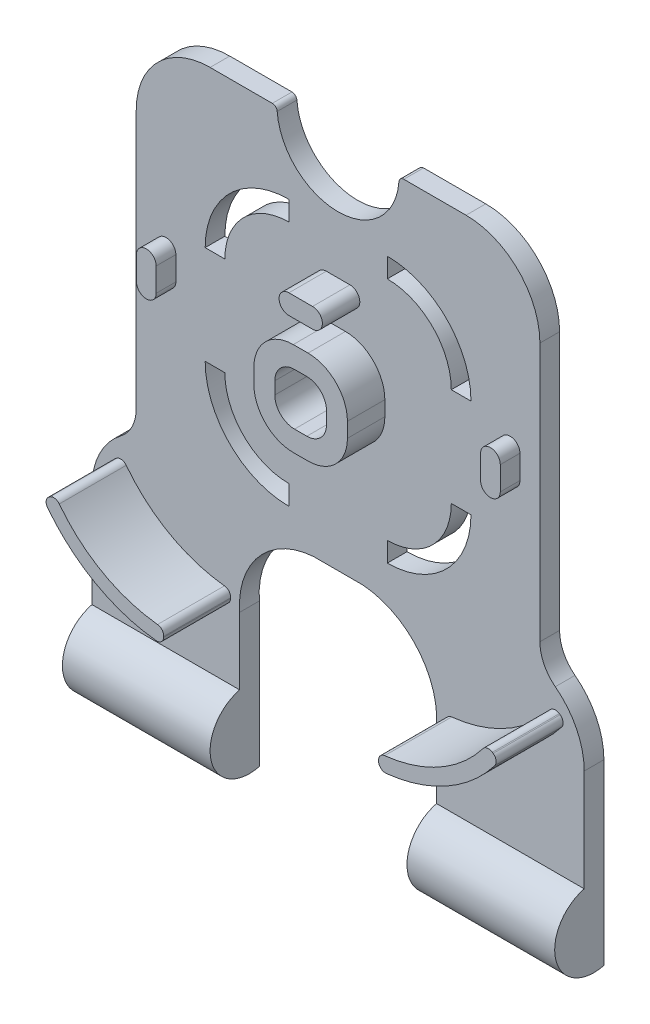
from build123d import *

# Parameters (mm, degrees)
BOSS_EXTRUDE1_DEPTH     = 4
BOSS_EXTRUDE5_DEPTH     = 100
CUT_EXTRUDE1_DEPTH      = 6
CUT_EXTRUDE1_DEPTH_BACK = 4
SKETCH10_W              = 40
SKETCH10_H              = 15.745966692
BOSS_EXTRUDE2_START     = 7.6
BOSS_EXTRUDE2_DEPTH     = 7.6
BOSS_EXTRUDE3_DEPTH     = 4
BOSS_EXTRUDE4_DEPTH     = 13.6


with BuildPart() as part:
    # Sketch5 → Boss-Extrude1 (new body)
    with BuildSketch(Plane.XY):
        with BuildLine():
            Line((24, 16.79919429), (36.637365529, 16.79919429))
            ThreePointArc((36.637365529, 16.79919429), (37.317576208, 16.532210956), (37.634577057, 15.873821155))
            ThreePointArc((37.634577057, 15.873821155), (50, 4.39919429), (62.365422943, 15.873821155))
            ThreePointArc((62.365422943, 15.873821155), (62.682423792, 16.532210956), (63.362634471, 16.79919429))
            Line((63.362634471, 16.79919429), (76, 16.79919429))
            ThreePointArc((76, 16.79919429), (86.606601718, 12.405796007), (91, 1.79919429))
            Line((91, 1.79919429), (91, -50.7428479))
            ThreePointArc((91, -50.7428479), (91.825164609, -54.281454563), (94.130434279, -57.09007798))
            ThreePointArc((94.130434279, -57.09007798), (98.452815572, -62.356247367), (100, -68.991135491))
            Line((100, -68.991135491), (100, -97.453476489))
            Line((100, -97.453476489), (70, -97.453476489))
            Line((70, -97.453476489), (70, -76.063355975))
            ThreePointArc((70, -76.063355975), (66.087194676, -64.29650022), (55, -58.7428479))
            Line((55, -58.7428479), (45, -58.7428479))
            ThreePointArc((45, -58.7428479), (33.912805324, -64.29650022), (30, -76.063355975))
            Line((30, -76.063355975), (30, -97.453476489))
            Line((30, -97.453476489), (0, -97.453476489))
            Line((0, -97.453476489), (0, -68.991135491))
            ThreePointArc((0, -68.991135491), (1.547183906, -62.356247464), (5.869565217, -57.090078366))
            ThreePointArc((5.869565217, -57.090078366), (8.17483525, -54.281454848), (9, -50.7428479))
            Line((9, -50.7428479), (9, 1.79919429))
            ThreePointArc((9, 1.79919429), (13.393398282, 12.405796007), (24, 16.79919429))
        make_face()
        with BuildLine():
            Line((23, -35.405583535), (27, -35.405583535))
            ThreePointArc((27, -35.405583535), (30.807611845, -44.59797169), (40, -48.405583535))
            Line((40, -48.405583535), (40, -52.405583535))
            ThreePointArc((40, -52.405583535), (27.97918472, -47.426398815), (23, -35.405583535))
        make_face(mode=Mode.SUBTRACT)
        with BuildLine():
            Line((60, -48.405583535), (60, -52.405583535))
            ThreePointArc((60, -52.405583535), (72.02081528, -47.426398815), (77, -35.405583535))
            Line((77, -35.405583535), (73, -35.405583535))
            ThreePointArc((73, -35.405583535), (69.192388155, -44.59797169), (60, -48.405583535))
        make_face(mode=Mode.SUBTRACT)
        with BuildLine():
            Line((73, -15.405583535), (77, -15.405583535))
            ThreePointArc((77, -15.405583535), (72.02081528, -3.384768255), (60, 1.594416465))
            Line((60, 1.594416465), (60, -2.405583535))
            ThreePointArc((60, -2.405583535), (69.192388155, -6.213195379), (73, -15.405583535))
        make_face(mode=Mode.SUBTRACT)
        with BuildLine():
            Line((40, -2.405583535), (40, 1.594416465))
            ThreePointArc((40, 1.594416465), (27.97918472, -3.384768255), (23, -15.405583535))
            Line((23, -15.405583535), (27, -15.405583535))
            ThreePointArc((27, -15.405583535), (30.807611845, -6.213195379), (40, -2.405583535))
        make_face(mode=Mode.SUBTRACT)
        with BuildLine():
            Line((48.75, -20.155583535), (51.25, -20.155583535))
            ThreePointArc((51.25, -20.155583535), (54.078427125, -21.32715641), (55.25, -24.155583535))
            Line((55.25, -24.155583535), (55.25, -26.655583535))
            ThreePointArc((55.25, -26.655583535), (54.078427125, -29.48401066), (51.25, -30.655583535))
            Line((51.25, -30.655583535), (48.75, -30.655583535))
            ThreePointArc((48.75, -30.655583535), (45.921572875, -29.48401066), (44.75, -26.655583535))
            Line((44.75, -26.655583535), (44.75, -24.155583535))
            ThreePointArc((44.75, -24.155583535), (45.921572875, -21.32715641), (48.75, -20.155583535))
        make_face(mode=Mode.SUBTRACT)
        with BuildLine():
            Line((47.613027863, -7.245609293), (52.413027863, -7.245609293))
            ThreePointArc((52.413027863, -7.245609293), (54.413027863, -9.245609293), (52.413027863, -11.245609293))
            Line((52.413027863, -11.245609293), (47.613027863, -11.245609293))
            ThreePointArc((47.613027863, -11.245609293), (45.613027863, -9.245609293), (47.613027863, -7.245609293))
        make_face(mode=Mode.SUBTRACT)
    extrude(amount=-BOSS_EXTRUDE1_DEPTH)

    # Sketch9 → Boss-Extrude5 (add)
    with BuildSketch(Plane(origin=(100, 0, 0), x_dir=(0, 0, -1), z_dir=(1, 0, 0))):
        with BuildLine():
            Line((0, -89.707509797), (0, -97.453476489))
            Line((0, -97.453476489), (4, -97.453476489))
            Line((4, -97.453476489), (4, -105.199443182))
            ThreePointArc((4, -105.199443182), (-5.745966692, -99.453476489), (0, -89.707509797))
        make_face()
    extrude(amount=-BOSS_EXTRUDE5_DEPTH)

    # Sketch10 → Cut-Extrude1 (cut, two sides: drawn at the far end of the back side and taken through both)
    with BuildSketch(Plane.XY.offset(-CUT_EXTRUDE1_DEPTH_BACK)):
        with Locations((50, -97.580493143)):
            Rectangle(SKETCH10_W, SKETCH10_H)
    extrude(amount=CUT_EXTRUDE1_DEPTH + CUT_EXTRUDE1_DEPTH_BACK, mode=Mode.SUBTRACT)

    # Sketch7 → Boss-Extrude2 (add)
    # profile 1 of 2: a face of its own
    with BuildSketch(Plane.XY.offset(BOSS_EXTRUDE2_START)):
        with BuildLine():
            Line((40.5, -23.905583535), (40.5, -26.905583535))
            ThreePointArc((40.5, -26.905583535), (42.843145751, -32.562437784), (48.5, -34.905583535))
            Line((48.5, -34.905583535), (51.5, -34.905583535))
            ThreePointArc((51.5, -34.905583535), (57.156854249, -32.562437784), (59.5, -26.905583535))
            Line((59.5, -26.905583535), (59.5, -23.905583535))
            ThreePointArc((59.5, -23.905583535), (57.156854249, -18.248729285), (51.5, -15.905583535))
            Line((51.5, -15.905583535), (48.5, -15.905583535))
            ThreePointArc((48.5, -15.905583535), (42.843145751, -18.248729285), (40.5, -23.905583535))
        make_face()
        with BuildLine():
            Line((44.75, -24.155583535), (44.75, -26.655583535))
            ThreePointArc((44.75, -26.655583535), (45.921572875, -29.48401066), (48.75, -30.655583535))
            Line((48.75, -30.655583535), (51.25, -30.655583535))
            ThreePointArc((51.25, -30.655583535), (54.078427125, -29.48401066), (55.25, -26.655583535))
            Line((55.25, -26.655583535), (55.25, -24.155583535))
            ThreePointArc((55.25, -24.155583535), (54.078427125, -21.32715641), (51.25, -20.155583535))
            Line((51.25, -20.155583535), (48.75, -20.155583535))
            ThreePointArc((48.75, -20.155583535), (45.921572875, -21.32715641), (44.75, -24.155583535))
        make_face(mode=Mode.SUBTRACT)
    # profile 2 of 2: a face of its own
    with BuildSketch(Plane.XY.offset(BOSS_EXTRUDE2_START)):
        with BuildLine():
            Line((47.613027863, -11.245609293), (52.413027863, -11.245609293))
            ThreePointArc((52.413027863, -11.245609293), (54.413027863, -9.245609293), (52.413027863, -7.245609293))
            Line((52.413027863, -7.245609293), (47.613027863, -7.245609293))
            ThreePointArc((47.613027863, -7.245609293), (45.613027863, -9.245609293), (47.613027863, -11.245609293))
        make_face()
    extrude(amount=-BOSS_EXTRUDE2_DEPTH)


with BuildPart() as boss_extrude2_piece_1:
    # of the separate pieces the step leaves, piece 1, a body of its own (boss_extrude2_pieces)
    add(part.part.solids().sort_by_distance((55, -58.7428479, 0))[0])

    # Sketch6 → Boss-Extrude3 (add)
    with BuildSketch(Plane.XY):
        with BuildLine():
            Line((13.05, -19.605583535), (13.05, -24.405583535))
            ThreePointArc((13.05, -24.405583535), (15.05, -26.405583535), (17.05, -24.405583535))
            Line((17.05, -24.405583535), (17.05, -19.605583535))
            ThreePointArc((17.05, -19.605583535), (15.05, -17.605583535), (13.05, -19.605583535))
        make_face()
        with BuildLine():
            Line((82.95, -19.605583535), (82.95, -24.405583535))
            ThreePointArc((82.95, -24.405583535), (84.95, -26.405583535), (86.95, -24.405583535))
            Line((86.95, -24.405583535), (86.95, -19.605583535))
            ThreePointArc((86.95, -19.605583535), (84.95, -17.605583535), (82.95, -19.605583535))
        make_face()
    extrude(amount=BOSS_EXTRUDE3_DEPTH)

    # Sketch8 → Boss-Extrude4 (add)
    with BuildSketch(Plane.XY):
        with BuildLine():
            Line((5.051952567, -61.420170717), (4.889119672, -61.533180939))
            ThreePointArc((4.889119672, -61.533180939), (4.304160695, -62.467013505), (4.576086991, -63.534850738))
            ThreePointArc((4.576086991, -63.534850738), (14.324723149, -71.991251845), (26.616139945, -75.924151508))
            ThreePointArc((26.616139945, -75.924151508), (27.669738102, -75.601426873), (28.163469962, -74.616313115))
            Line((28.163469962, -74.616313115), (28.175379043, -74.418464598))
            ThreePointArc((28.175379043, -74.418464598), (27.846661517, -73.430042168), (26.926294201, -72.942232658))
            ThreePointArc((26.926294201, -72.942232658), (15.789594598, -69.385306206), (6.962344462, -61.719964799))
            ThreePointArc((6.962344462, -61.719964799), (6.067224815, -61.187240734), (5.051952567, -61.420170717))
        make_face()
        with BuildLine():
            Line((71.824620957, -74.418464598), (71.836530038, -74.616313115))
            ThreePointArc((71.836530038, -74.616313115), (72.330261898, -75.601426873), (73.383860055, -75.924151508))
            ThreePointArc((73.383860055, -75.924151508), (85.675276851, -71.991251845), (95.423913009, -63.534850738))
            ThreePointArc((95.423913009, -63.534850738), (95.695839305, -62.467013505), (95.110880328, -61.533180939))
            Line((95.110880328, -61.533180939), (94.948047433, -61.420170717))
            ThreePointArc((94.948047433, -61.420170717), (93.932775185, -61.187240734), (93.037655538, -61.719964799))
            ThreePointArc((93.037655538, -61.719964799), (84.210405402, -69.385306206), (73.073705799, -72.942232658))
            ThreePointArc((73.073705799, -72.942232658), (72.153338483, -73.430042168), (71.824620957, -74.418464598))
        make_face()
    extrude(amount=BOSS_EXTRUDE4_DEPTH)


with BuildPart() as boss_extrude2_piece_2:
    # of the separate pieces the step leaves, piece 2, a body of its own (boss_extrude2_pieces)
    add(part.part.solids().sort_by_distance((47.613027863, -7.245609293, 7.6))[0])


solid = Compound([boss_extrude2_piece_1.part, boss_extrude2_piece_2.part])
